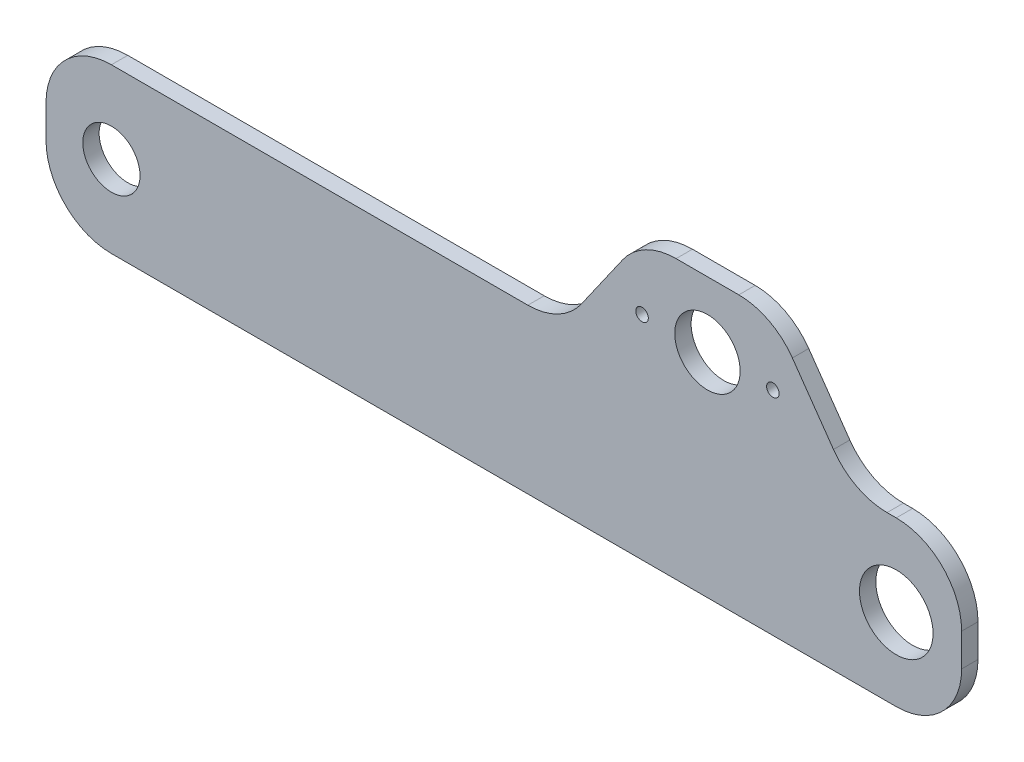
from build123d import *

# Parameters (mm, degrees)
LAYOUT_R            = 11.1125
LAYOUT_R_2          = 14.2875
LAYOUT_R_3          = 2.4384
LAYOUT_R_4          = 12.7
BOSS_EXTRUDE1_DEPTH = 6.35


with BuildPart() as part:
    # Layout → Boss-Extrude1 (new body)
    with BuildSketch(Plane.XY):
        with BuildLine():
            Line((36.96482124, 44.45), (341.76482124, 44.45))
            ThreePointArc((341.76482124, 44.45), (359.725333482, 51.889487758), (367.16482124, 69.85))
            Line((367.16482124, 69.85), (367.16482124, 82.55))
            ThreePointArc((367.16482124, 82.55), (359.725333482, 100.510512242), (341.76482124, 107.95))
            Line((341.76482124, 107.95), (338.192123961, 107.95))
            ThreePointArc((338.192123961, 107.95), (326.463709185, 110.819924837), (317.385662036, 118.781158517))
            Line((317.385662036, 118.781158517), (301.429554645, 141.568841483))
            ThreePointArc((301.429554645, 141.568841483), (292.351507496, 149.530075163), (280.62309272, 152.4))
            Line((280.62309272, 152.4), (256.267898888, 152.4))
            ThreePointArc((256.267898888, 152.4), (244.539484112, 149.530075163), (235.461436963, 141.568841483))
            Line((235.461436963, 141.568841483), (219.505329571, 118.781158517))
            ThreePointArc((219.505329571, 118.781158517), (210.427282423, 110.819924837), (198.698867646, 107.95))
            Line((198.698867646, 107.95), (36.96482124, 107.95))
            ThreePointArc((36.96482124, 107.95), (19.004308998, 100.510512242), (11.56482124, 82.55))
            Line((11.56482124, 82.55), (11.56482124, 69.85))
            ThreePointArc((11.56482124, 69.85), (19.004308998, 51.889487758), (36.96482124, 44.45))
        make_face()
        with Locations((36.96482124, 76.2)):
            Circle(LAYOUT_R, mode=Mode.SUBTRACT)
        with Locations((341.76482124, 76.2)):
            Circle(LAYOUT_R_2, mode=Mode.SUBTRACT)
        with Locations((243.045495804, 127)):
            Circle(LAYOUT_R_3, mode=Mode.SUBTRACT)
        with Locations((293.845495804, 127)):
            Circle(LAYOUT_R_3, mode=Mode.SUBTRACT)
        with Locations((268.445495804, 127)):
            Circle(LAYOUT_R_4, mode=Mode.SUBTRACT)
    extrude(amount=BOSS_EXTRUDE1_DEPTH)


solid = part.part
